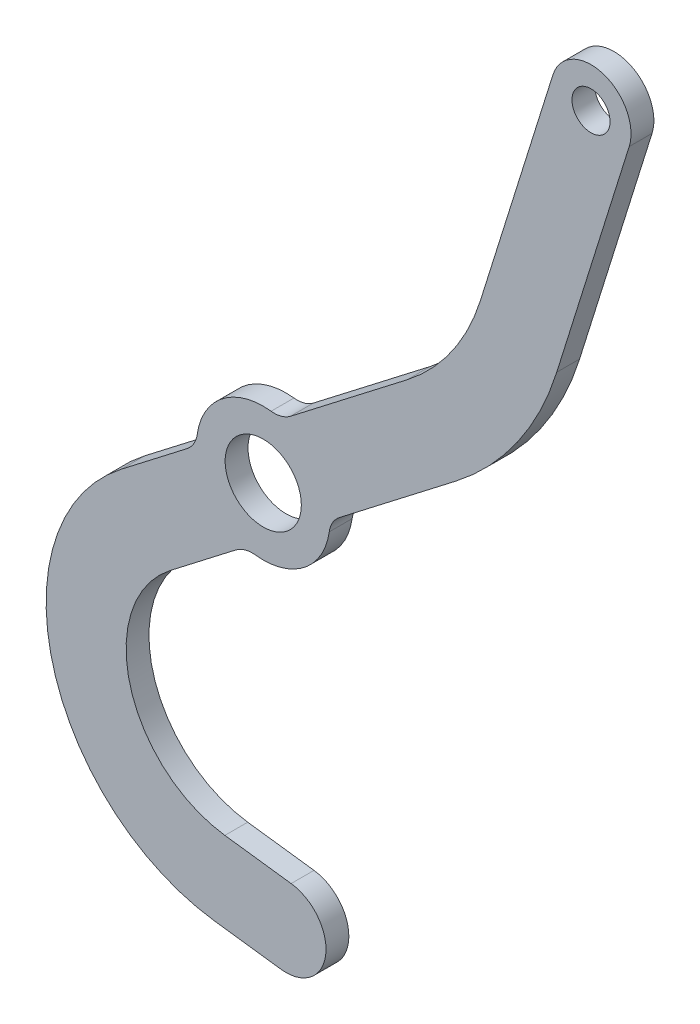
from build123d import *

# Parameters (mm, degrees)
BOSS_EXTRUDE1_DEPTH = 8.571428571
SCALE1_SCALE        = 0.35
SKETCH4_R           = 5
SKETCH4_R_2         = 2.5
CUT_EXTRUDE1_DEPTH  = 3


with BuildPart() as part:
    # Sketch1 → Boss-Extrude1 (new body)
    with BuildSketch(Plane.XY):
        with BuildLine():
            Line((58.123111297, 76.596610431), (85.302723175, 163.49128587))
            ThreePointArc((85.302723175, 163.49128587), (104.096629497, 173.329430267), (113.934773893, 154.535523945))
            Line((113.934773893, 154.535523945), (86.755162015, 67.640848506))
            ThreePointArc((86.755162015, 67.640848506), (72.021658749, 37.591328154), (48.934001898, 13.363041111))
            Line((48.934001898, 13.363041111), (5.217217629, -20.341042592))
            ThreePointArc((5.217217629, -20.341042592), (2.676812565, -23.236266616), (1.419146317, -26.876906073))
            ThreePointArc((1.419146317, -26.876906073), (-8.076031964, -43.216564777), (-26.293681135, -48.242509049))
            ThreePointArc((-26.293681135, -48.242509049), (-30.134490911, -48.532613024), (-33.580740804, -50.252886758))
            Line((-33.580740804, -50.252886758), (-58.231756308, -69.257941768))
            ThreePointArc((-58.231756308, -69.257941768), (-73.309006949, -114.009842439), (-37.733455904, -145.065216667))
            Line((-37.733455904, -145.065216667), (-12.872173051, -148.280481329))
            ThreePointArc((-12.872173051, -148.280481329), (0.08003541, -165.080490138), (-16.719973399, -178.032698599))
            Line((-16.719973399, -178.032698599), (-41.581256252, -174.817433937))
            ThreePointArc((-41.581256252, -174.817433937), (-102.268960976, -121.840619078), (-76.548945176, -45.499141462))
            Line((-76.548945176, -45.499141462), (-51.897929672, -26.494086452))
            ThreePointArc((-51.897929672, -26.494086452), (-49.357524607, -23.598862428), (-48.09985836, -19.958222971))
            ThreePointArc((-48.09985836, -19.958222971), (-38.604680078, -3.618564267), (-20.387030907, 1.407380005))
            ThreePointArc((-20.387030907, 1.407380005), (-16.546221132, 1.69748398), (-13.099971239, 3.417757714))
            Line((-13.099971239, 3.417757714), (30.61681303, 37.121841417))
            ThreePointArc((30.61681303, 37.121841417), (47.407836194, 54.742413811), (58.123111297, 76.596610431))
        make_face()
    extrude(amount=BOSS_EXTRUDE1_DEPTH)


with BuildPart() as part_1:
    # Scale1: scaled about (-2.128000964, -18.472945164, 4.285714286)
    add(part.part.scale(SCALE1_SCALE).moved(Location((-1.383200627, -12.007414357, 2.785714286))))

    # Sketch4 → Cut-Extrude1 (cut)
    with BuildSketch(Plane.XY.offset(5.785714286)):
        with Locations((-9.552325234, -20.203561939)):
            Circle(SKETCH4_R)
        with Locations((33.48336136, 43.647277361)):
            Circle(SKETCH4_R_2)
    extrude(amount=-CUT_EXTRUDE1_DEPTH, mode=Mode.SUBTRACT)


solid = part_1.part
